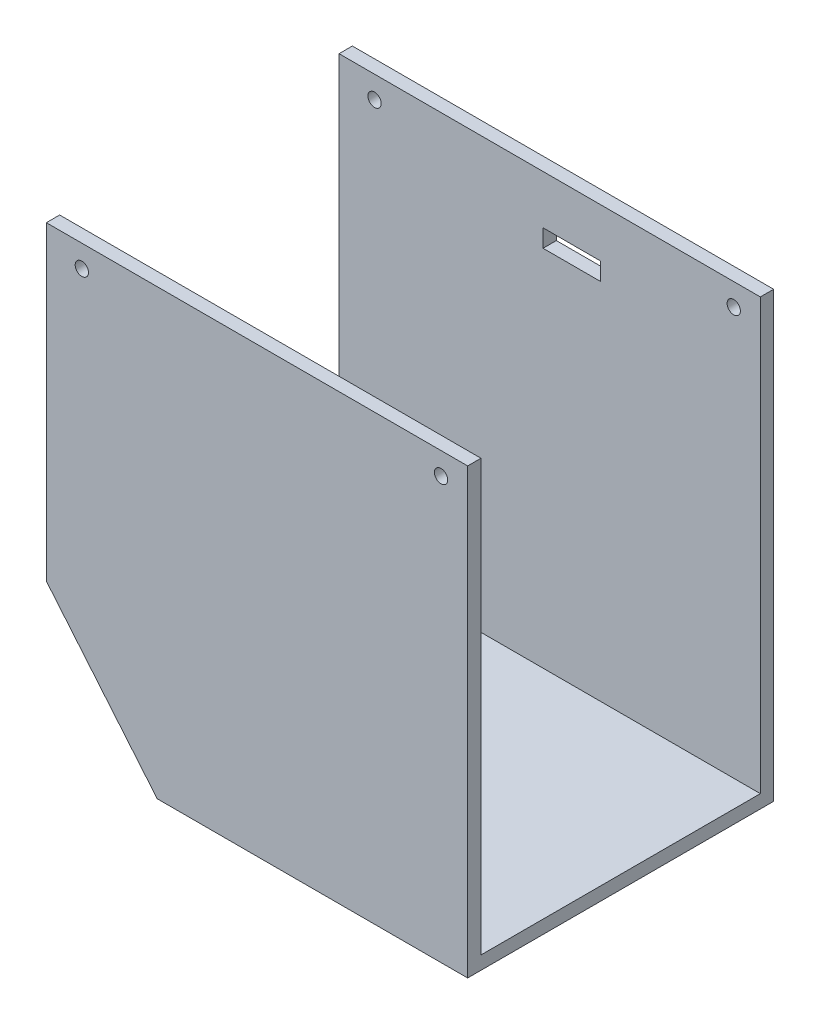
from build123d import *

# Parameters (mm, degrees)
SKETCH1_W           = 95
SKETCH1_H           = 69
BOSS_EXTRUDE1_DEPTH = 3
SKETCH2_W           = 95
SKETCH2_H           = 3
BOSS_EXTRUDE2_DEPTH = 100
SKETCH3_W           = 95
SKETCH3_H           = 3
BOSS_EXTRUDE3_DEPTH = 100
SKETCH4_W           = 95
SKETCH4_H           = 3
CUT_EXTRUDE1_DEPTH  = 100
SKETCH5_W           = 25
SKETCH5_H           = 36
CUT_EXTRUDE2_DEPTH  = 1.5
SKETCH6_W           = 30
SKETCH6_H           = 30
CUT_EXTRUDE3_DEPTH  = 1.5
SKETCH7_R           = 1.5
CUT_EXTRUDE5_DEPTH  = 131.052204064
CUT_EXTRUDE6_DEPTH  = 131.052204064
SKETCH9_W           = 13
SKETCH9_H           = 4
CUT_EXTRUDE9_DEPTH  = 10


with BuildPart() as part:
    # Sketch1 → Boss-Extrude1 (new body)
    with BuildSketch(Plane(origin=(0, 0, 0), x_dir=(1, 0, 0), z_dir=(0, 1, 0))):
        with Locations((4.879154079, 9.171450151)):
            Rectangle(SKETCH1_W, SKETCH1_H)
    extrude(amount=-BOSS_EXTRUDE1_DEPTH)

    # Sketch2 → Boss-Extrude2 (add)
    with BuildSketch(Plane(origin=(0, 0, 0), x_dir=(1, 0, 0), z_dir=(0, 1, 0))):
        with Locations((4.879154079, -23.828549849)):
            Rectangle(SKETCH2_W, SKETCH2_H)
    extrude(amount=BOSS_EXTRUDE2_DEPTH)

    # Sketch3 → Boss-Extrude3 (add)
    with BuildSketch(Plane(origin=(0, 0, 0), x_dir=(1, 0, 0), z_dir=(0, 1, 0))):
        with Locations((4.879154079, 42.171450151)):
            Rectangle(SKETCH3_W, SKETCH3_H)
    extrude(amount=BOSS_EXTRUDE3_DEPTH)

    # Sketch4 → Cut-Extrude1 (cut)
    with BuildSketch(Plane(origin=(0, 0, -43.671450151), x_dir=(-1, 0, 0), z_dir=(0, 0, -1))):
        with Locations((-4.879154079, 98.5)):
            Rectangle(SKETCH4_W, SKETCH4_H)
    extrude(amount=-CUT_EXTRUDE1_DEPTH, mode=Mode.SUBTRACT)

    # Sketch5 → Cut-Extrude2 (cut)
    with BuildSketch(Plane(origin=(0, 0, -43.671450151), x_dir=(-1, 0, 0), z_dir=(0, 0, -1))):
        with Locations((-9.879154079, 20)):
            Rectangle(SKETCH5_W, SKETCH5_H)
    extrude(amount=-CUT_EXTRUDE2_DEPTH, mode=Mode.SUBTRACT)

    # Sketch6 → Cut-Extrude3 (cut)
    with BuildSketch(Plane.XZ.offset(3)):
        with Locations((7.379154079, -18.671450151)):
            Rectangle(SKETCH6_W, SKETCH6_H)
    extrude(amount=-CUT_EXTRUDE3_DEPTH, mode=Mode.SUBTRACT)

    # Sketch7 → Cut-Extrude5 (cut, through all)
    with BuildSketch(Plane(origin=(0, 0, -43.671450151), x_dir=(-1, 0, 0), z_dir=(0, 0, -1))):
        with Locations((34.620845921, 92)):
            Circle(SKETCH7_R)
        with Locations((-46.379154079, 92)):
            Circle(SKETCH7_R)
    extrude(amount=-CUT_EXTRUDE5_DEPTH, mode=Mode.SUBTRACT)

    # Sketch8 → Cut-Extrude6 (cut, through all)
    with BuildSketch(Plane(origin=(0, 0, -43.671450151), x_dir=(-1, 0, 0), z_dir=(0, 0, -1))):
        Polygon((42.620845921, -3), (17.620845921, -3), (42.620845921, 27), align=None)
    extrude(amount=-CUT_EXTRUDE6_DEPTH, mode=Mode.SUBTRACT)

    # Sketch9 → Cut-Extrude9 (cut)
    with BuildSketch(Plane(origin=(0, 0, -43.671450151), x_dir=(-1, 0, 0), z_dir=(0, 0, -1))):
        with Locations((-9.879154079, 84)):
            Rectangle(SKETCH9_W, SKETCH9_H)
    extrude(amount=-CUT_EXTRUDE9_DEPTH, mode=Mode.SUBTRACT)


solid = part.part
